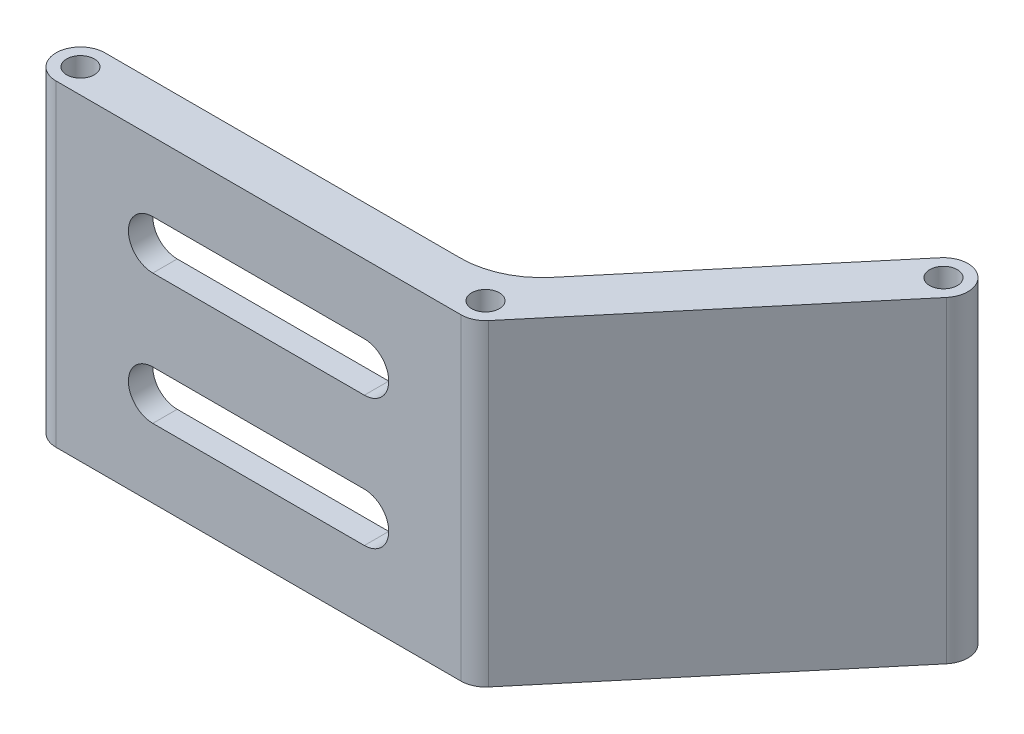
from build123d import *

# Parameters (mm, degrees)
SKETCH_1_R          = 1.7
EXTRUDE_1_DEPTH     = 39
FILLET_1_R          = 10
SKETCH_3_R          = 1.7
EXTRUDE_2_DEPTH     = 5
EXTRUDE_START       = -3
SKETCH_4_R          = 1.7
EXTRUDE_3_DEPTH     = 3
CUT_EXTRUDE_2_DEPTH = 5
SKETCH_6_R          = 1.7
EXTRUDE_4_DEPTH     = 3
SKETCH_7_R          = 1.7
EXTRUDE_5_DEPTH     = 5
SKETCH_8_R          = 3
SKETCH_8_R_2        = 1.7
EXTRUDE_6_DEPTH     = 39
SKETCH_9_R          = 1.7
CUT_EXTRUDE_3_DEPTH = 100
FILLET_2_R          = 10


with BuildPart() as part:
    # 草图1 → 凸台-拉伸1 (new body)
    with BuildSketch(Plane(origin=(0, 0, 0), x_dir=(1, 0, 0), z_dir=(0, 1, 0))):
        with BuildLine():
            Line((-14.277701198, -3), (35.505461262, -3))
            ThreePointArc((35.505461262, -3), (36.773316047, -2.718923361), (37.803594591, -1.928362829))
            Line((37.803594591, -1.928362829), (63.497014217, 28.691862316))
            Line((63.497014217, 28.691862316), (61.198880888, 30.620225145))
            Line((61.198880888, 30.620225145), (37.433824091, 2.298133329))
            ThreePointArc((37.433824091, 2.298133329), (34.237606477, 2.718923361), (32.505461262, 0))
            Line((32.505461262, 0), (-11.277701198, 0))
            ThreePointArc((-11.277701198, 0), (-16.399021541, 2.121320344), (-14.277701198, -3))
        make_face()
        with Locations(Location((-14.277701198, 0, 0), (0, 0, 270))):
            Circle(SKETCH_1_R, mode=Mode.SUBTRACT)
        with Locations(Location((35.505461262, 0, 0), (0, 0, 270))):
            Circle(SKETCH_1_R, mode=Mode.SUBTRACT)
    extrude(amount=EXTRUDE_1_DEPTH)

    # 圆角1
    fillet_1_edges = [part.edges().sort_by_distance(p)[0] for p in [
        (37.433824091, 19.5, -2.298133329),
        (-11.277701198, 19.5, 0),
        (32.505461262, 19.5, 0),
    ]]
    fillet(fillet_1_edges, radius=FILLET_1_R)

    # 草图3 → 凸台-拉伸2 (add)
    with BuildSketch(Plane(origin=(0, 0, 0), x_dir=(1, 0, 0), z_dir=(0, 1, 0))):
        with BuildLine():
            Line((-14.277701198, 3), (35.505461262, 3))
            ThreePointArc((35.505461262, 3), (38.505461262, 0), (35.505461262, -3))
            Line((35.505461262, -3), (-14.277701198, -3))
            ThreePointArc((-14.277701198, -3), (-17.277701198, 0), (-14.277701198, 3))
        make_face()
        with Locations(Location((35.505461262, 0, 0), (0, 0, 270))):
            Circle(SKETCH_3_R, mode=Mode.SUBTRACT)
    extrude(amount=EXTRUDE_2_DEPTH)

    # 草图4 → 凸台-拉伸3 (add)
    with BuildSketch(Plane(origin=(0, 39, 0), x_dir=(1, 0, 0), z_dir=(0, 1, 0)).offset(EXTRUDE_START)):
        with BuildLine():
            Line((-14.277701198, 3), (35.505461262, 3))
            ThreePointArc((35.505461262, 3), (38.505461262, 0), (35.505461262, -3))
            Line((35.505461262, -3), (-14.277701198, -3))
            ThreePointArc((-14.277701198, -3), (-17.277701198, 0), (-14.277701198, 3))
        make_face()
        with Locations(Location((-14.277701198, 0, 0), (0, 0, 270))):
            Circle(SKETCH_4_R, mode=Mode.SUBTRACT)
        with Locations(Location((35.505461262, 0, 0), (0, 0, 270))):
            Circle(SKETCH_4_R, mode=Mode.SUBTRACT)
    extrude(amount=EXTRUDE_3_DEPTH)

    # 草图5 → 切除-拉伸2 (cut)
    with BuildSketch(Plane.XY.offset(3)):
        with BuildLine():
            Line((-2.386119968, 30.5), (23.613880032, 30.5))
            ThreePointArc((23.613880032, 30.5), (26.613880032, 27.5), (23.613880032, 24.5))
            Line((23.613880032, 24.5), (-2.386119968, 24.5))
            ThreePointArc((-2.386119968, 24.5), (-5.386119968, 27.5), (-2.386119968, 30.5))
        make_face()
        with BuildLine():
            Line((-2.386119968, 8.5), (23.613880032, 8.5))
            ThreePointArc((23.613880032, 8.5), (26.613880032, 11.5), (23.613880032, 14.5))
            Line((23.613880032, 14.5), (-2.386119968, 14.5))
            ThreePointArc((-2.386119968, 14.5), (-5.386119968, 11.5), (-2.386119968, 8.5))
        make_face()
    extrude(amount=-CUT_EXTRUDE_2_DEPTH, mode=Mode.SUBTRACT)

    # 草图6 → 凸台-拉伸4 (add)
    with BuildSketch(Plane(origin=(0, 39, 0), x_dir=(1, 0, 0), z_dir=(0, 1, 0)).offset(EXTRUDE_START)):
        with BuildLine():
            Line((33.207327933, 1.928362829), (58.890388489, 32.536242516))
            ThreePointArc((58.890388489, 32.536242516), (63.116884647, 32.906013016), (63.486655148, 28.679516858))
            Line((63.486655148, 28.679516858), (37.803594591, -1.928362829))
            ThreePointArc((37.803594591, -1.928362829), (33.577098433, -2.298133329), (33.207327933, 1.928362829))
        make_face()
        with Locations(Location((35.505461262, 0, 0), (0, 0, 270))):
            Circle(SKETCH_6_R, mode=Mode.SUBTRACT)
        with Locations((61.188521818, 30.607879687)):
            Circle(SKETCH_6_R, mode=Mode.SUBTRACT)
    extrude(amount=EXTRUDE_4_DEPTH)

    # 草图7 → 凸台-拉伸5 (add)
    with BuildSketch(Plane(origin=(0, 0, 0), x_dir=(1, 0, 0), z_dir=(0, 1, 0))):
        with BuildLine():
            Line((33.207327933, 1.928362829), (58.890388489, 32.536242516))
            ThreePointArc((58.890388489, 32.536242516), (63.116884647, 32.906013016), (63.486655148, 28.679516858))
            Line((63.486655148, 28.679516858), (37.803594591, -1.928362829))
            ThreePointArc((37.803594591, -1.928362829), (33.577098433, -2.298133329), (33.207327933, 1.928362829))
        make_face()
        with Locations(Location((35.505461262, 0, 0), (0, 0, 270))):
            Circle(SKETCH_7_R, mode=Mode.SUBTRACT)
        with Locations((61.188521818, 30.607879687)):
            Circle(SKETCH_7_R, mode=Mode.SUBTRACT)
    extrude(amount=EXTRUDE_5_DEPTH)

    # 草图8 → 凸台-拉伸6 (add)
    with BuildSketch(Plane(origin=(0, 0, 0), x_dir=(1, 0, 0), z_dir=(0, 1, 0))):
        with Locations((61.188521818, 30.607879687)):
            Circle(SKETCH_8_R)
        with Locations((61.188521818, 30.607879687)):
            Circle(SKETCH_8_R_2, mode=Mode.SUBTRACT)
    extrude(amount=EXTRUDE_6_DEPTH)

    # 草图9 → 切除-拉伸3 (cut)
    with BuildSketch(Plane(origin=(0, 0, 0), x_dir=(1, 0, 0), z_dir=(0, 1, 0))):
        with Locations(Location((61.188521818, 30.607879687, 0), (0, 0, 270))):
            Circle(SKETCH_9_R)
    extrude(amount=CUT_EXTRUDE_3_DEPTH, mode=Mode.SUBTRACT)

    # 圆角2
    fillet_2_edges = [part.edges().sort_by_distance(p)[0] for p in [
        (34.106538287, 37.5, -3),
        (34.106538287, 2.5, -3),
    ]]
    fillet(fillet_2_edges, radius=FILLET_2_R)


solid = part.part
